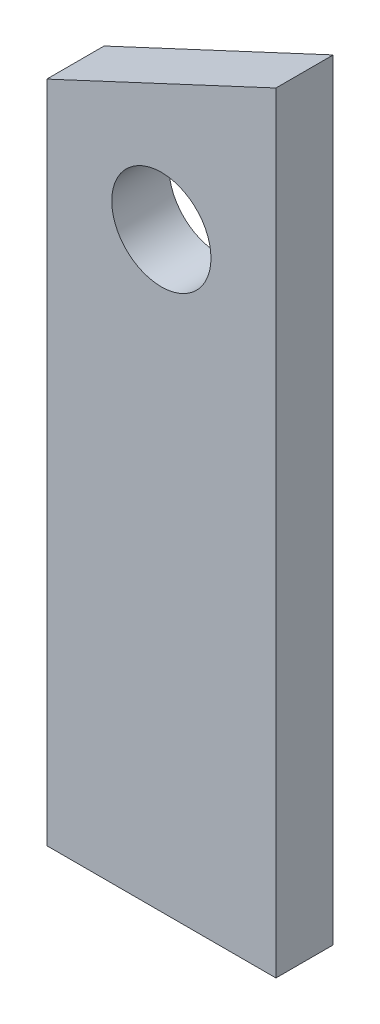
from build123d import *

# Parameters (mm, degrees)
SKETCH2_W           = 12.7
SKETCH2_H           = 3.175
BOSS_EXTRUDE1_DEPTH = 63.5
CUT_EXTRUDE1_REACH  = 66.835
SKETCH3_R           = 2.75


with BuildPart() as part:
    # Sketch2 → Boss-Extrude1 (new body)
    with BuildSketch(Plane(origin=(0, 0, 0), x_dir=(1, 0, 0), z_dir=(0, 1, 0))):
        with Locations((6.35, -1.5875)):
            Rectangle(SKETCH2_W, SKETCH2_H)
    extrude(amount=BOSS_EXTRUDE1_DEPTH)

    # Sketch3 → Cut-Extrude1 (cut, up to next)
    with BuildSketch(Plane(origin=(0, 0, 3.175), x_dir=(-1, 0, 0), z_dir=(0, 0, -1)), mode=Mode.PRIVATE) as cut_extrude1_sk1:
        with Locations(Location((-6.35, 32.750792521, 0), (0, 0, 180))):
            Circle(SKETCH3_R)
    cut_extrude1_tool1 = extrude(cut_extrude1_sk1.sketch, amount=CUT_EXTRUDE1_REACH, mode=Mode.PRIVATE) & part.part
    # Sketch3 → Cut-Extrude1 (cut, up to next)
    with BuildSketch(Plane(origin=(0, 0, 3.175), x_dir=(-1, 0, 0), z_dir=(0, 0, -1)), mode=Mode.PRIVATE) as cut_extrude1_sk2:
        Polygon((-12.723149047, 42.732029586), (0, 36.79912775), (0, 63.5), (-12.7, 63.5), align=None)
    cut_extrude1_tool2 = extrude(cut_extrude1_sk2.sketch, amount=CUT_EXTRUDE1_REACH, mode=Mode.PRIVATE) & part.part
    add(cut_extrude1_tool1.solids().sort_by_distance((6.35, 32.750793, 3.175))[0], mode=Mode.SUBTRACT)
    add(cut_extrude1_tool2.solids().sort_by_distance((6.091267, 51.567007, 3.175))[0], mode=Mode.SUBTRACT)


solid = part.part
